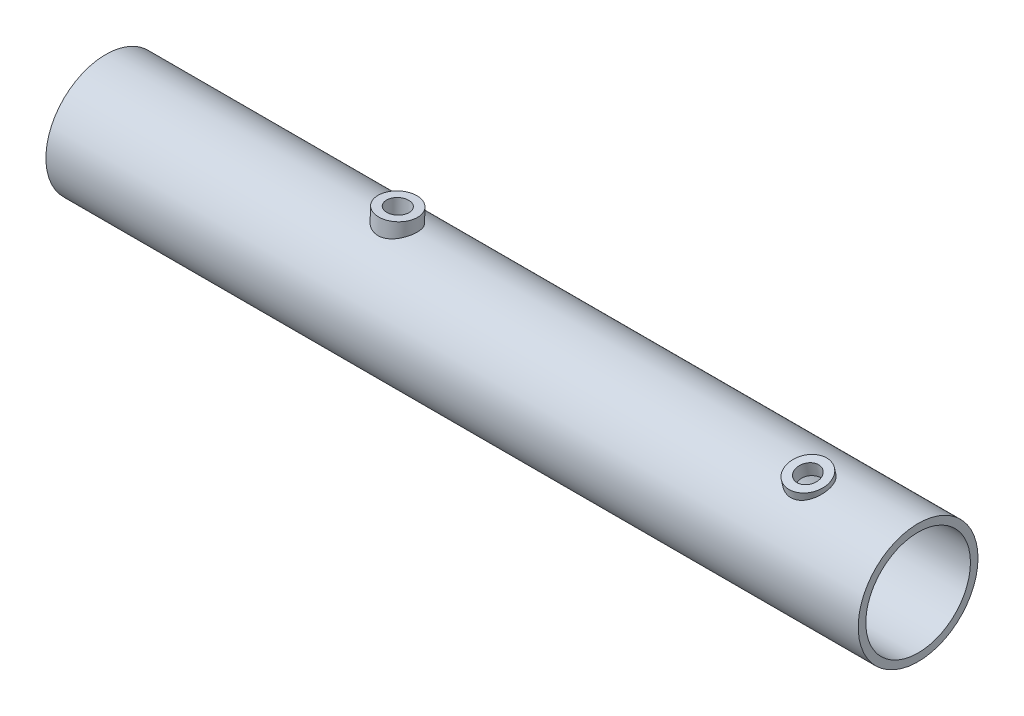
from build123d import *

# Parameters (mm, degrees)
IZIM1_R                          = 21.75
IZIM1_R_2                        = 19
Y_KSEKLIK_EKSTR_ZYON1_DEPTH      = 295
Y_KSEKLIK_EKSTR_ZYON2_REACH      = 301.598
Y_KSEKLIK_EKSTR_ZYON2_END_RADIUS = 21.75
IZIM5_R                          = 7
IZIM5_R_2                        = 4
Y_KSEKLIK_EKSTR_ZYON3_REACH      = 301.678
Y_KSEKLIK_EKSTR_ZYON3_END_RADIUS = 21.75
IZIM6_R                          = 7
IZIM6_R_2                        = 4
IZIM7_R                          = 4
KES_EKSTR_ZYON1_DEPTH            = 10
IZIM8_R                          = 4
KES_EKSTR_ZYON2_DEPTH            = 20


with BuildPart() as part:
    # Çizim1 → Yükseklik-Ekstrüzyon1 (new body)
    with BuildSketch(Plane(origin=(0, 0, 0), x_dir=(0, 0, -1), z_dir=(1, 0, 0))):
        Circle(IZIM1_R)
        Circle(IZIM1_R_2, mode=Mode.SUBTRACT)
    extrude(amount=Y_KSEKLIK_EKSTR_ZYON1_DEPTH)

    # Yükseklik-Ekstrüzyon2: up to this cylinder (the profile starts outside it)
    y_kseklik_ekstr_zyon2_end = Plane(origin=(260.45925, 0, 0), z_dir=(-1, 0, 0)) * Cylinder(Y_KSEKLIK_EKSTR_ZYON2_END_RADIUS, 647.696, mode=Mode.PRIVATE)
    # Çizim5 → Yükseklik-Ekstrüzyon2 (add, up to the surface)
    with BuildSketch(Plane(origin=(0.022625841, 23.166571161, 5.264124015), x_dir=(0.9999995464719378, -0.0009275610339678473, -0.00021607046786515594), z_dir=(-0.0009523808029177918, -0.9751415620700296, -0.22158074576647907)), mode=Mode.PRIVATE) as y_kseklik_ekstr_zyon2_sk1:
        with Locations(Location((260.436740743, 0.291462923, 0), (0, 0, 90.000296198))):
            Circle(IZIM5_R)
        with Locations(Location((260.436740743, 0.291462923, 0), (0, 0, 90.000296198))):
            Circle(IZIM5_R_2, mode=Mode.SUBTRACT)
    y_kseklik_ekstr_zyon2_tool1 = extrude(y_kseklik_ekstr_zyon2_sk1.sketch, amount=Y_KSEKLIK_EKSTR_ZYON2_REACH, mode=Mode.PRIVATE) - y_kseklik_ekstr_zyon2_end
    add(y_kseklik_ekstr_zyon2_tool1.solids().sort_by_distance((260.45925, 24.367613, -1.140857))[0])

    # Yükseklik-Ekstrüzyon3: up to this cylinder (the profile starts outside it)
    y_kseklik_ekstr_zyon3_end = Plane(origin=(105.467864, 0, 0), z_dir=(-1, 0, 0)) * Cylinder(Y_KSEKLIK_EKSTR_ZYON3_END_RADIUS, 647.856, mode=Mode.PRIVATE)
    # Çizim6 → Yükseklik-Ekstrüzyon3 (add, up to the surface)
    with BuildSketch(Plane(origin=(0.192055035, 27.157330053, -0.682085947), x_dir=(0.9999750105265257, -0.0070673060727465585, 0.00017750309572102488), z_dir=(-0.007069534813187566, -0.9996597585608946, 0.025107544513539345)), mode=Mode.PRIVATE) as y_kseklik_ekstr_zyon3_sk1:
        with Locations(Location((105.278439441, 0.08752168, 0), (0, 0, 90))):
            Circle(IZIM6_R)
        with Locations(Location((105.278439441, 0.08752168, 0), (0, 0, 90))):
            Circle(IZIM6_R_2, mode=Mode.SUBTRACT)
    y_kseklik_ekstr_zyon3_tool1 = extrude(y_kseklik_ekstr_zyon3_sk1.sketch, amount=Y_KSEKLIK_EKSTR_ZYON3_REACH, mode=Mode.PRIVATE) - y_kseklik_ekstr_zyon3_end
    add(y_kseklik_ekstr_zyon3_tool1.solids().sort_by_distance((105.467864, 26.244707, -7.37577))[0])

    # Çizim7 → Kes-Ekstrüzyon1 (cut)
    with BuildSketch(Plane(origin=(0.022625841, 23.166571161, 5.264124015), x_dir=(0.9999995464719378, -0.0009275610339678465, -0.00021607046786515985), z_dir=(0.0009523808029177919, 0.9751415620700297, 0.22158074576647907))):
        with Locations(Location((260.436740743, -0.291462923, 0), (0, 0, 269.999703802))):
            Circle(IZIM7_R)
    extrude(amount=-KES_EKSTR_ZYON1_DEPTH, mode=Mode.SUBTRACT)

    # Çizim8 → Kes-Ekstrüzyon2 (cut)
    with BuildSketch(Plane(origin=(0.192055035, 27.157330053, -0.682085947), x_dir=(0.9999750105265257, -0.007067306072746558, 0.00017750309572102494), z_dir=(0.007069534813187564, 0.9996597585608945, -0.025107544513539328))):
        with Locations(Location((105.278439441, -0.08752168, 0), (0, 0, 270))):
            Circle(IZIM8_R)
    extrude(amount=-KES_EKSTR_ZYON2_DEPTH, mode=Mode.SUBTRACT)


solid = part.part
